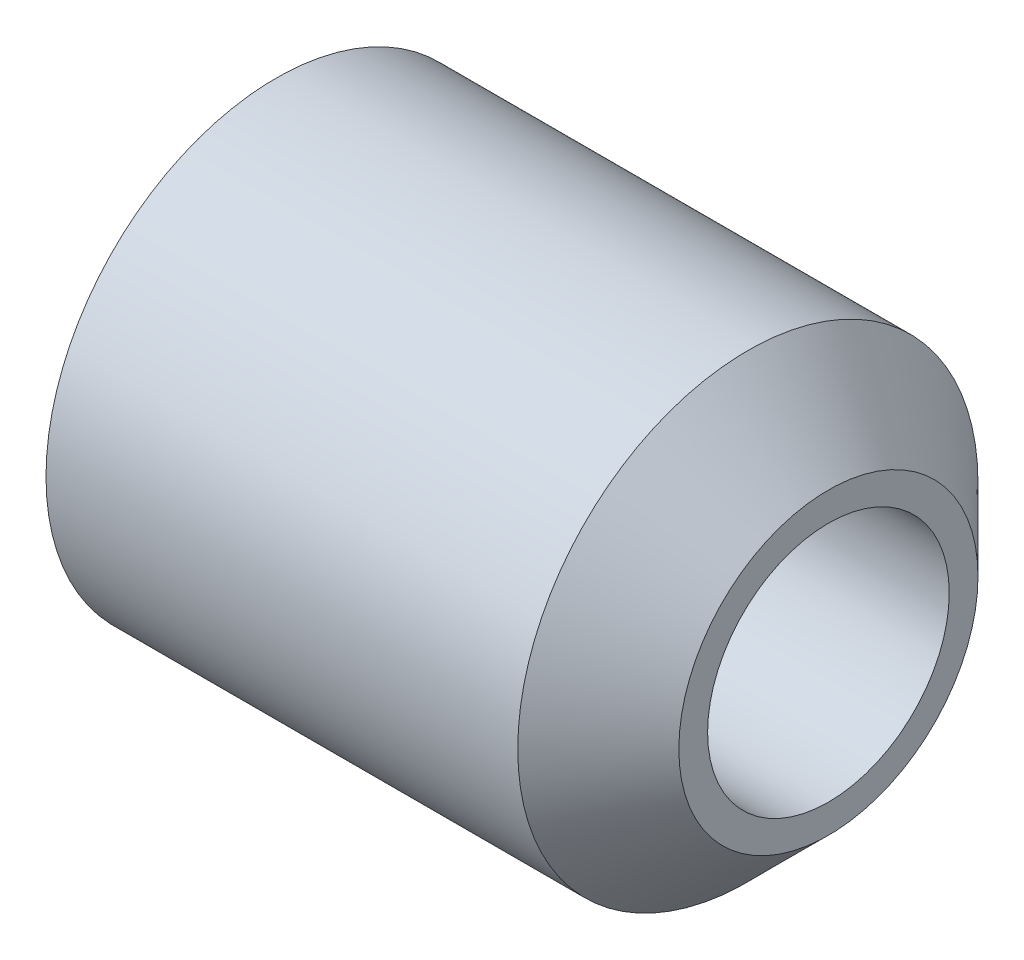
from build123d import *

# Parameters (mm, degrees)
SKETCH2_R           = 10
SKETCH2_R_2         = 5.25
BOSS_EXTRUDE1_DEPTH = 24
CHAMFER1_SIZE       = 3.5


with BuildPart() as part:
    # Sketch2 → Boss-Extrude1 (new body)
    with BuildSketch(Plane(origin=(0, 0, 0), x_dir=(0, 0, -1), z_dir=(1, 0, 0))):
        Circle(SKETCH2_R)
        Circle(SKETCH2_R_2, mode=Mode.SUBTRACT)
    extrude(amount=BOSS_EXTRUDE1_DEPTH)

    # Chamfer1
    chamfer1_edges = [part.edges().sort_by_distance(p)[0] for p in [
        (24, 0, 10),
    ]]
    chamfer(chamfer1_edges, length=CHAMFER1_SIZE)


solid = part.part
